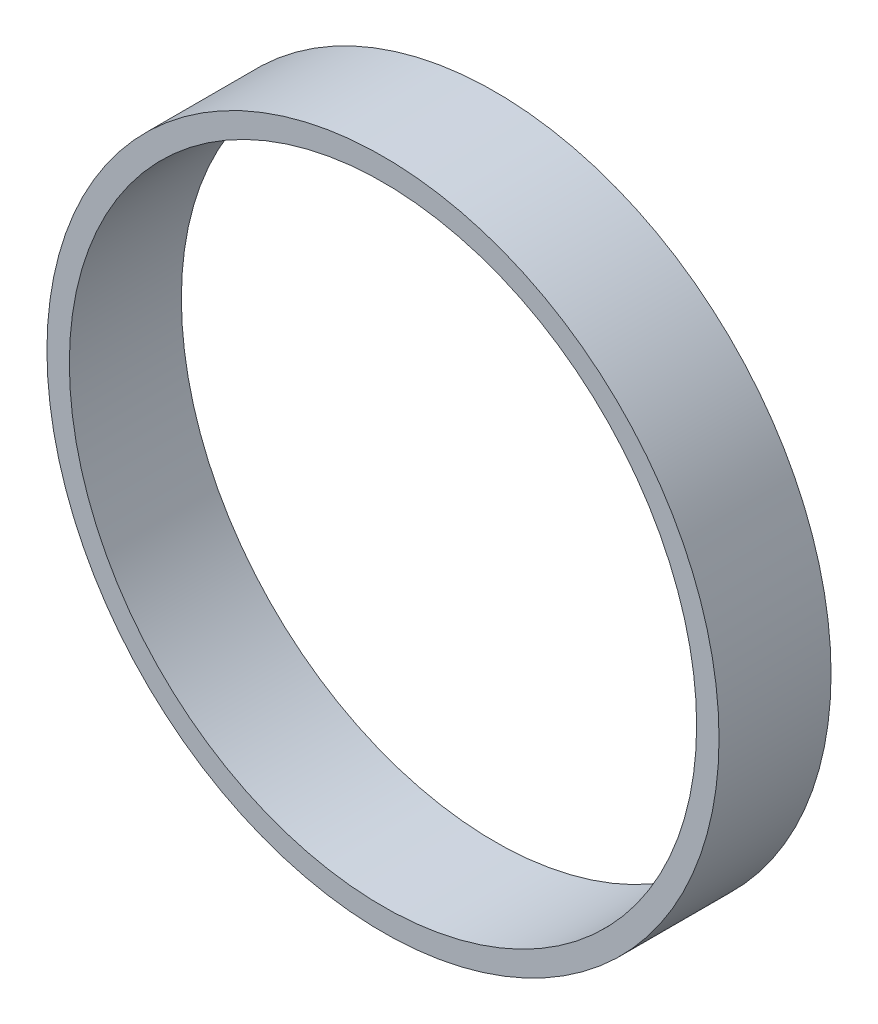
from build123d import *

# Parameters (mm, degrees)
SKETCH_1_R      = 60
SKETCH_1_R_2    = 56
EXTRUDE_1_DEPTH = 20


with BuildPart() as part:
    # Эскиз1 → Бобышка-Вытянуть1 (new body)
    with BuildSketch(Plane.XY):
        Circle(SKETCH_1_R)
        Circle(SKETCH_1_R_2, mode=Mode.SUBTRACT)
    extrude(amount=EXTRUDE_1_DEPTH)


solid = part.part
